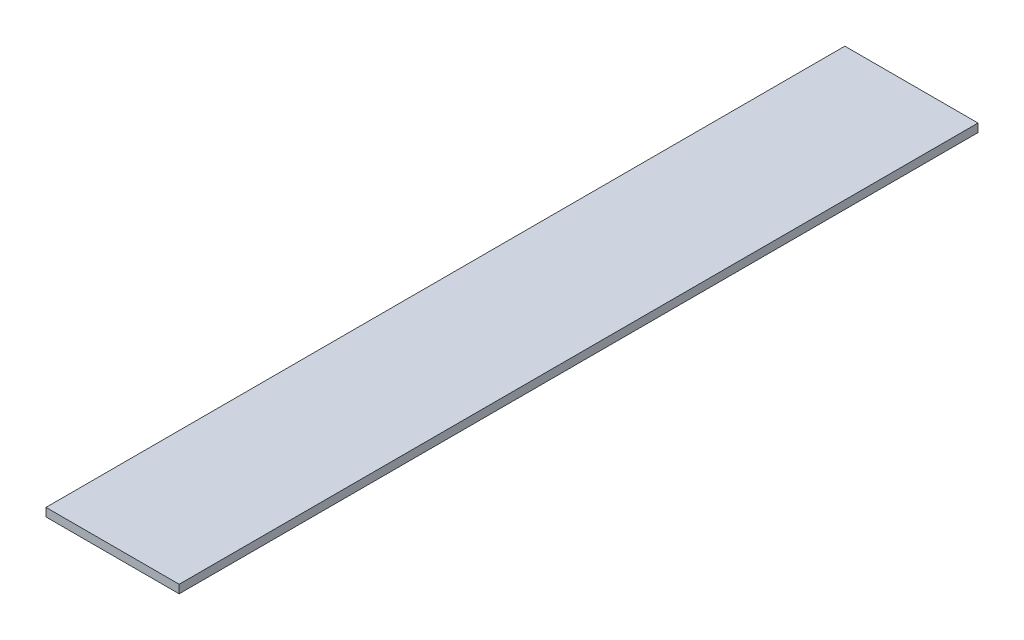
from build123d import *

# Parameters (mm, degrees)
SKETCH1_W           = 50.8
SKETCH1_H           = 3.175
BOSS_EXTRUDE1_DEPTH = 304.8


with BuildPart() as part:
    # Sketch1 → Boss-Extrude1 (new body)
    with BuildSketch(Plane.XY):
        Rectangle(SKETCH1_W, SKETCH1_H)
    extrude(amount=BOSS_EXTRUDE1_DEPTH)


solid = part.part
